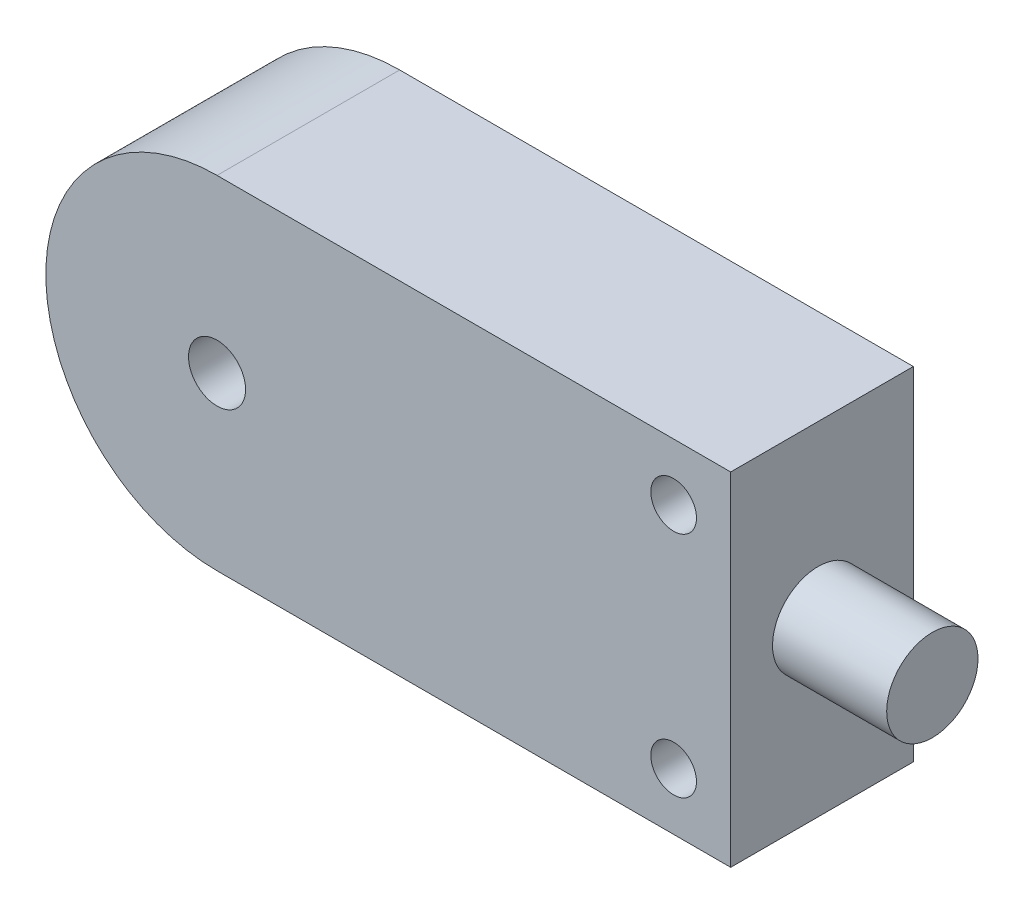
from build123d import *

# Parameters (mm, degrees)
SKETCH1_R           = 2
SKETCH1_R_2         = 2.5
BOSS_EXTRUDE1_DEPTH = 16
SKETCH2_R           = 4
BOSS_EXTRUDE2_DEPTH = 10


with BuildPart() as part:
    # Sketch1 → Boss-Extrude1 (new body)
    with BuildSketch(Plane.XY):
        with BuildLine():
            Line((0, 15), (45, 15))
            Line((45, 15), (45, -15))
            Line((45, -15), (0, -15))
            ThreePointArc((0, -15), (-15, 0), (0, 15))
        make_face()
        with Locations((40, 10)):
            Circle(SKETCH1_R, mode=Mode.SUBTRACT)
        with Locations((40, -10)):
            Circle(SKETCH1_R, mode=Mode.SUBTRACT)
        Circle(SKETCH1_R_2, mode=Mode.SUBTRACT)
    extrude(amount=BOSS_EXTRUDE1_DEPTH)

    # Sketch2 → Boss-Extrude2 (add)
    with BuildSketch(Plane(origin=(45, 0, 0), x_dir=(0, 0, -1), z_dir=(1, 0, 0))):
        with Locations(Location((-8.334071627, 0, 0), (0, 0, 270))):
            Circle(SKETCH2_R)
    extrude(amount=BOSS_EXTRUDE2_DEPTH)


solid = part.part
